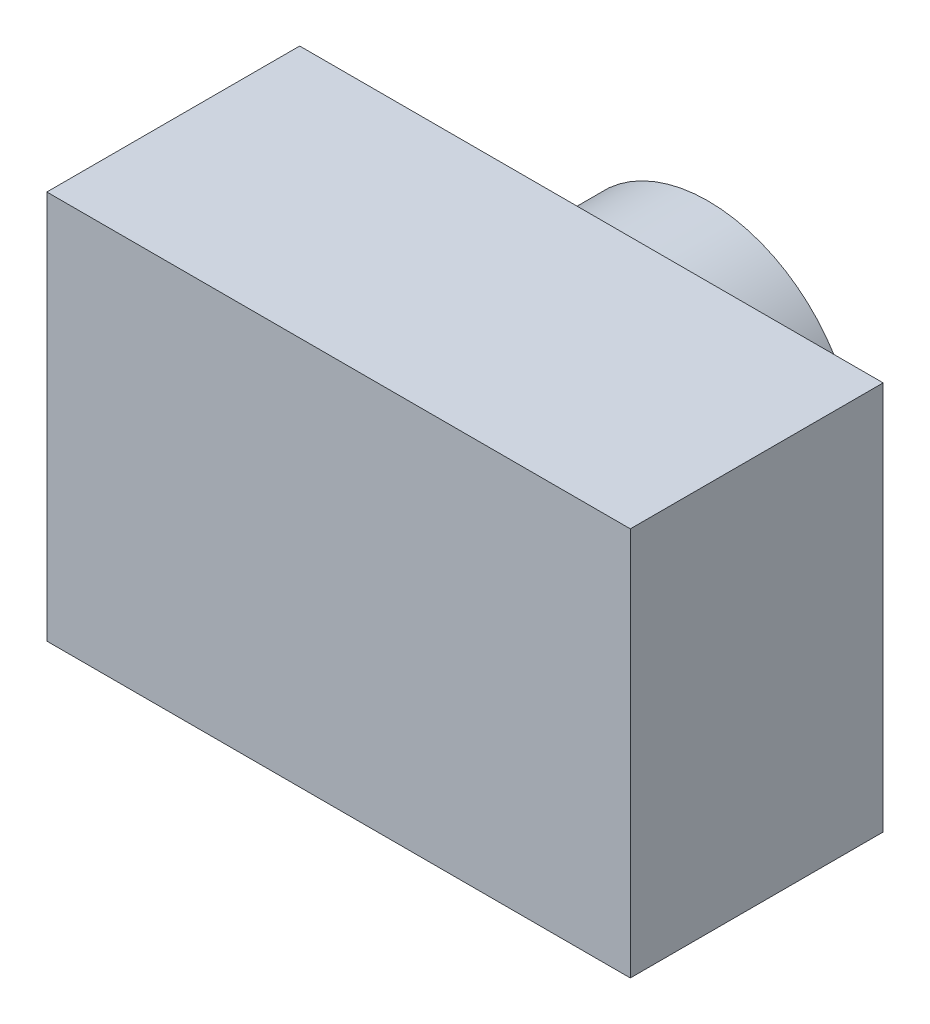
from build123d import *

# Parameters (mm, degrees)
SKETCH_1_W          = 150
SKETCH_1_H          = 100
EXTRUDE_1_DEPTH     = 65
SKETCH_4_W          = 140
SKETCH_4_H          = 90
CUT_EXTRUDE_1_DEPTH = 55
SKETCH_5_R          = 38
EXTRUDE_2_DEPTH     = 30


with BuildPart() as part:
    # 草图1 → 凸台-拉伸1 (new body)
    with BuildSketch(Plane.XY):
        Rectangle(SKETCH_1_W, SKETCH_1_H)
    extrude(amount=EXTRUDE_1_DEPTH)

    # 草图4 → 切除-拉伸1 (cut)
    with BuildSketch(Plane.XY.offset(60)):
        Rectangle(SKETCH_4_W, SKETCH_4_H)
    extrude(amount=-CUT_EXTRUDE_1_DEPTH, mode=Mode.SUBTRACT)

    # 草图5 → 凸台-拉伸2 (add)
    with BuildSketch(Plane(origin=(0, 0, 0), x_dir=(-1, 0, 0), z_dir=(0, 0, -1))):
        with Locations(Location((0, 0, 0), (0, 0, 180))):
            Circle(SKETCH_5_R)
    extrude(amount=EXTRUDE_2_DEPTH)


solid = part.part
